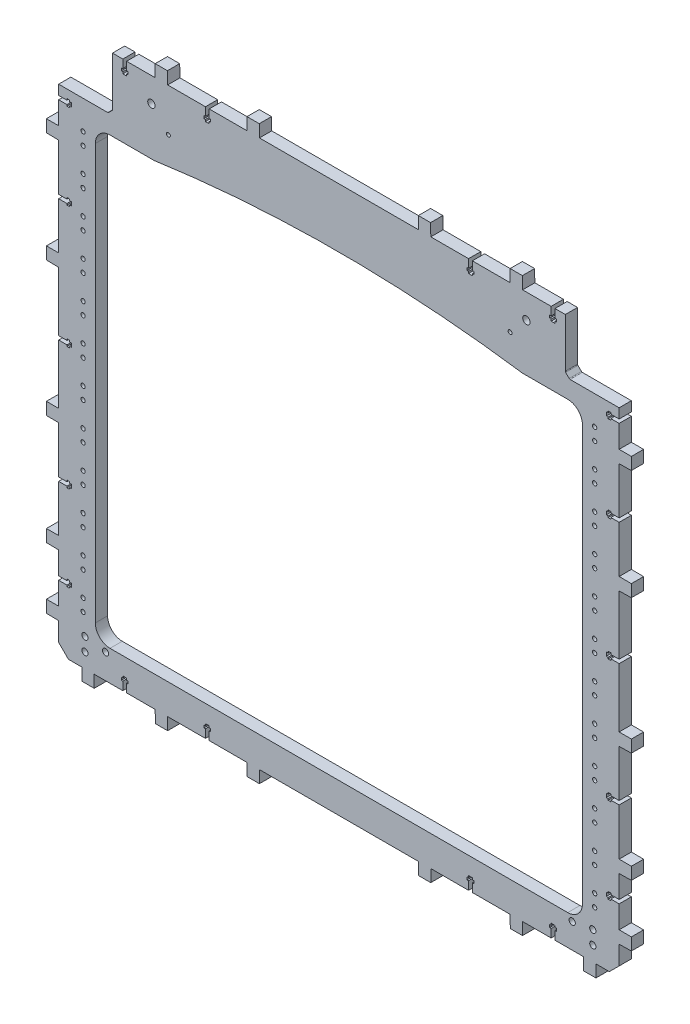
from build123d import *

# Parameters (mm, degrees)
SKETCH_1_R      = 1.75
SKETCH_1_R_2    = 2.55
SKETCH_1_R_3    = 3
SKETCH_1_R_4    = 1.6
EXTRUDE_1_DEPTH = 10


with BuildPart() as part:
    # Эскиз1 → Бобышка-Вытянуть1 (new body)
    with BuildSketch(Plane.XY):
        with BuildLine():
            Line((109.05, 213), (105.95, 213))
            Line((105.95, 213), (105.95, 214.5))
            Line((105.95, 214.5), (104.75, 214.5))
            Line((104.75, 214.5), (104.75, 216.7))
            Line((104.75, 216.7), (105.95, 216.7))
            Line((105.95, 216.7), (105.95, 223.5))
            Line((105.95, 223.5), (75.100000001, 223.5))
            Line((75.100000001, 223.5), (74.933356476, 233.498611401))
            Line((74.933356476, 233.498611401), (64.933356476, 233.498611401))
            Line((64.933356476, 233.498611401), (64.9, 223.5))
            Line((64.9, 223.5), (-64.899999999, 223.5))
            Line((-64.899999999, 223.5), (-65.066643524, 233.498611401))
            Line((-65.066643524, 233.498611401), (-75.066643524, 233.498611401))
            Line((-75.066643524, 233.498611401), (-75.1, 223.5))
            Line((-75.1, 223.5), (-105.95, 223.5))
            Line((-105.95, 223.5), (-105.95, 216.7))
            Line((-105.95, 216.7), (-104.75, 216.7))
            Line((-104.75, 216.7), (-104.75, 214.5))
            Line((-104.75, 214.5), (-105.95, 214.5))
            Line((-105.95, 214.5), (-105.95, 213))
            Line((-105.95, 213), (-109.05, 213))
            Line((-109.05, 213), (-109.05, 214.5))
            Line((-109.05, 214.5), (-110.25, 214.5))
            Line((-110.25, 214.5), (-110.25, 216.7))
            Line((-110.25, 216.7), (-109.05, 216.7))
            Line((-109.05, 216.7), (-109.05, 223.5))
            Line((-109.05, 223.5), (-139.899999999, 223.5))
            Line((-139.899999999, 223.5), (-140.066643524, 233.498611401))
            Line((-140.066643524, 233.498611401), (-150.066643524, 233.498611401))
            Line((-150.066643524, 233.498611401), (-150.1, 223.5))
            Line((-150.1, 223.5), (-173.45, 223.5))
            Line((-173.45, 223.5), (-173.45, 216.7))
            Line((-173.45, 216.7), (-172.25, 216.7))
            Line((-172.25, 216.7), (-172.25, 214.5))
            Line((-172.25, 214.5), (-173.45, 214.5))
            Line((-173.45, 214.5), (-173.45, 213))
            Line((-173.45, 213), (-176.55, 213))
            Line((-176.55, 213), (-176.55, 214.5))
            Line((-176.55, 214.5), (-177.75, 214.5))
            Line((-177.75, 214.5), (-177.75, 216.7))
            Line((-177.75, 216.7), (-176.55, 216.7))
            Line((-176.55, 216.7), (-176.55, 223.5))
            Line((-176.55, 223.5), (-185, 223.5))
            Line((-185, 223.5), (-185, 183.414213563))
            ThreePointArc((-185, 183.414213563), (-185.076120468, 183.03153013), (-185.292893219, 182.707106782))
            Line((-185.292893219, 182.707106782), (-188.207106781, 179.792893219))
            ThreePointArc((-188.207106781, 179.792893219), (-188.53153013, 179.576120468), (-188.914213562, 179.5))
            Line((-188.914213562, 179.5), (-229, 179.5))
            Line((-229, 179.5), (-229, 171.550000001))
            Line((-229, 171.550000001), (-222.2, 171.550000001))
            Line((-222.2, 171.550000001), (-222.2, 172.750000001))
            Line((-222.2, 172.750000001), (-220, 172.750000001))
            Line((-220, 172.750000001), (-220, 171.550000001))
            Line((-220, 171.550000001), (-218.5, 171.550000001))
            Line((-218.5, 171.550000001), (-218.5, 168.450000001))
            Line((-218.5, 168.450000001), (-220, 168.450000001))
            Line((-220, 168.450000001), (-220, 167.250000001))
            Line((-220, 167.250000001), (-222.2, 167.250000001))
            Line((-222.2, 167.250000001), (-222.2, 168.450000001))
            Line((-222.2, 168.450000001), (-229, 168.450000001))
            Line((-229, 168.450000001), (-229, 150.100000001))
            Line((-229, 150.100000001), (-238.9986114, 150.066643525))
            Line((-238.9986114, 150.066643525), (-238.9986114, 140.066643525))
            Line((-238.9986114, 140.066643525), (-229, 139.9))
            Line((-229, 139.9), (-229, 101.550000001))
            Line((-229, 101.550000001), (-222.2, 101.550000001))
            Line((-222.2, 101.550000001), (-222.2, 102.750000001))
            Line((-222.2, 102.750000001), (-220, 102.750000001))
            Line((-220, 102.750000001), (-220, 101.550000001))
            Line((-220, 101.550000001), (-218.5, 101.550000001))
            Line((-218.5, 101.550000001), (-218.5, 98.450000001))
            Line((-218.5, 98.450000001), (-220, 98.450000001))
            Line((-220, 98.450000001), (-220, 97.250000001))
            Line((-220, 97.250000001), (-222.2, 97.250000001))
            Line((-222.2, 97.250000001), (-222.2, 98.450000001))
            Line((-222.2, 98.450000001), (-229, 98.450000001))
            Line((-229, 98.450000001), (-229, 60.100000001))
            Line((-229, 60.100000001), (-238.9986114, 60.066643525))
            Line((-238.9986114, 60.066643525), (-238.9986114, 50.066643525))
            Line((-238.9986114, 50.066643525), (-229, 49.9))
            Line((-229, 49.9), (-229, 1.55))
            Line((-229, 1.55), (-222.2, 1.55))
            Line((-222.2, 1.55), (-222.2, 2.75))
            Line((-222.2, 2.75), (-220, 2.75))
            Line((-220, 2.75), (-220, 1.55))
            Line((-220, 1.55), (-218.5, 1.55))
            Line((-218.5, 1.55), (-218.5, -1.55))
            Line((-218.5, -1.55), (-220, -1.55))
            Line((-220, -1.55), (-220, -2.75))
            Line((-220, -2.75), (-222.2, -2.75))
            Line((-222.2, -2.75), (-222.2, -1.55))
            Line((-222.2, -1.55), (-229, -1.55))
            Line((-229, -1.55), (-229, -49.9))
            Line((-229, -49.9), (-238.998611401, -49.933356476))
            Line((-238.998611401, -49.933356476), (-238.998611401, -59.933356476))
            Line((-238.998611401, -59.933356476), (-229, -60.100000001))
            Line((-229, -60.100000001), (-229, -98.45))
            Line((-229, -98.45), (-222.2, -98.45))
            Line((-222.2, -98.45), (-222.2, -97.25))
            Line((-222.2, -97.25), (-220, -97.25))
            Line((-220, -97.25), (-220, -98.45))
            Line((-220, -98.45), (-218.5, -98.45))
            Line((-218.5, -98.45), (-218.5, -101.55))
            Line((-218.5, -101.55), (-220, -101.55))
            Line((-220, -101.55), (-220, -102.75))
            Line((-220, -102.75), (-222.2, -102.75))
            Line((-222.2, -102.75), (-222.2, -101.55))
            Line((-222.2, -101.55), (-229, -101.55))
            Line((-229, -101.55), (-229, -139.9))
            Line((-229, -139.9), (-238.998611401, -139.933356476))
            Line((-238.998611401, -139.933356476), (-238.998611401, -149.933356476))
            Line((-238.998611401, -149.933356476), (-229, -150.100000001))
            Line((-229, -150.100000001), (-229, -168.45))
            Line((-229, -168.45), (-222.2, -168.45))
            Line((-222.2, -168.45), (-222.2, -167.25))
            Line((-222.2, -167.25), (-220, -167.25))
            Line((-220, -167.25), (-220, -168.45))
            Line((-220, -168.45), (-218.5, -168.45))
            Line((-218.5, -168.45), (-218.5, -171.55))
            Line((-218.5, -171.55), (-220, -171.55))
            Line((-220, -171.55), (-220, -172.75))
            Line((-220, -172.75), (-222.2, -172.75))
            Line((-222.2, -172.75), (-222.2, -171.55))
            Line((-222.2, -171.55), (-229, -171.55))
            Line((-229, -171.55), (-229, -189.9))
            Line((-229, -189.9), (-238.998611401, -189.933356476))
            Line((-238.998611401, -189.933356476), (-238.998611401, -199.933356476))
            Line((-238.998611401, -199.933356476), (-229, -200.100000001))
            Line((-229, -200.100000001), (-229, -215.5))
            Line((-229, -215.5), (-221, -223.5))
            Line((-221, -223.5), (-210.100000001, -223.5))
            Line((-210.100000001, -223.5), (-209.933356476, -233.4986114))
            Line((-209.933356476, -233.4986114), (-199.933356476, -233.4986114))
            Line((-199.933356476, -233.4986114), (-199.9, -223.5))
            Line((-199.9, -223.5), (-176.55, -223.5))
            Line((-176.55, -223.5), (-176.55, -216.7))
            Line((-176.55, -216.7), (-177.749999999, -216.7))
            Line((-177.749999999, -216.7), (-177.749999999, -214.5))
            Line((-177.749999999, -214.5), (-176.549999999, -214.5))
            Line((-176.549999999, -214.5), (-176.549999999, -213))
            Line((-176.549999999, -213), (-173.449999999, -213))
            Line((-173.449999999, -213), (-173.449999999, -214.5))
            Line((-173.449999999, -214.5), (-172.25, -214.5))
            Line((-172.25, -214.5), (-172.25, -216.7))
            Line((-172.25, -216.7), (-173.45, -216.7))
            Line((-173.45, -216.7), (-173.45, -223.5))
            Line((-173.45, -223.5), (-150.100000001, -223.5))
            Line((-150.100000001, -223.5), (-149.933356476, -233.498611401))
            Line((-149.933356476, -233.498611401), (-139.933356476, -233.498611401))
            Line((-139.933356476, -233.498611401), (-139.9, -223.5))
            Line((-139.9, -223.5), (-109.05, -223.5))
            Line((-109.05, -223.5), (-109.05, -216.7))
            Line((-109.05, -216.7), (-110.249999999, -216.7))
            Line((-110.249999999, -216.7), (-110.249999999, -214.5))
            Line((-110.249999999, -214.5), (-109.049999999, -214.5))
            Line((-109.049999999, -214.5), (-109.049999999, -213))
            Line((-109.049999999, -213), (-105.949999999, -213))
            Line((-105.949999999, -213), (-105.949999999, -214.5))
            Line((-105.949999999, -214.5), (-104.75, -214.5))
            Line((-104.75, -214.5), (-104.75, -216.7))
            Line((-104.75, -216.7), (-105.95, -216.7))
            Line((-105.95, -216.7), (-105.95, -223.5))
            Line((-105.95, -223.5), (-75.1, -223.5))
            Line((-75.1, -223.5), (-74.933356476, -233.498611401))
            Line((-74.933356476, -233.498611401), (-64.933356476, -233.498611401))
            Line((-64.933356476, -233.498611401), (-64.9, -223.5))
            Line((-64.9, -223.5), (64.9, -223.5))
            Line((64.9, -223.5), (65.066643524, -233.498611401))
            Line((65.066643524, -233.498611401), (75.066643524, -233.498611401))
            Line((75.066643524, -233.498611401), (75.1, -223.5))
            Line((75.1, -223.5), (105.95, -223.5))
            Line((105.95, -223.5), (105.95, -216.7))
            Line((105.95, -216.7), (104.75, -216.7))
            Line((104.75, -216.7), (104.75, -214.5))
            Line((104.75, -214.5), (105.95, -214.5))
            Line((105.95, -214.5), (105.95, -213))
            Line((105.95, -213), (109.05, -213))
            Line((109.05, -213), (109.05, -214.5))
            Line((109.05, -214.5), (110.25, -214.5))
            Line((110.25, -214.5), (110.25, -216.7))
            Line((110.25, -216.7), (109.05, -216.7))
            Line((109.05, -216.7), (109.05, -223.5))
            Line((109.05, -223.5), (139.9, -223.5))
            Line((139.9, -223.5), (140.066643524, -233.4986114))
            Line((140.066643524, -233.4986114), (150.028559144, -233.4986114))
            Line((150.028559144, -233.4986114), (150.1, -223.5))
            Line((150.1, -223.5), (173.45, -223.5))
            Line((173.45, -223.5), (173.45, -216.7))
            Line((173.45, -216.7), (172.25, -216.7))
            Line((172.25, -216.7), (172.25, -214.5))
            Line((172.25, -214.5), (173.45, -214.5))
            Line((173.45, -214.5), (173.45, -213))
            Line((173.45, -213), (176.55, -213))
            Line((176.55, -213), (176.55, -214.5))
            Line((176.55, -214.5), (177.75, -214.5))
            Line((177.75, -214.5), (177.75, -216.7))
            Line((177.75, -216.7), (176.55, -216.7))
            Line((176.55, -216.7), (176.55, -223.5))
            Line((176.55, -223.5), (199.9, -223.5))
            Line((199.9, -223.5), (200.066643523, -233.4986114))
            Line((200.066643523, -233.4986114), (210.028559144, -233.4986114))
            Line((210.028559144, -233.4986114), (210.1, -223.5))
            Line((210.1, -223.5), (221, -223.5))
            Line((221, -223.5), (229, -215.5))
            Line((229, -215.5), (229, -200.100000001))
            Line((229, -200.100000001), (238.9986114, -199.933356476))
            Line((238.9986114, -199.933356476), (238.9986114, -189.933356476))
            Line((238.9986114, -189.933356476), (229, -189.9))
            Line((229, -189.9), (229, -171.55))
            Line((229, -171.55), (222.2, -171.55))
            Line((222.2, -171.55), (222.2, -172.75))
            Line((222.2, -172.75), (220, -172.75))
            Line((220, -172.75), (220, -171.55))
            Line((220, -171.55), (218.5, -171.55))
            Line((218.5, -171.55), (218.5, -168.45))
            Line((218.5, -168.45), (220, -168.45))
            Line((220, -168.45), (220, -167.25))
            Line((220, -167.25), (222.2, -167.25))
            Line((222.2, -167.25), (222.2, -168.45))
            Line((222.2, -168.45), (229, -168.45))
            Line((229, -168.45), (229, -150.100000001))
            Line((229, -150.100000001), (238.998611401, -149.933356476))
            Line((238.998611401, -149.933356476), (238.998611401, -139.933356476))
            Line((238.998611401, -139.933356476), (229, -139.9))
            Line((229, -139.9), (229, -101.55))
            Line((229, -101.55), (222.2, -101.55))
            Line((222.2, -101.55), (222.2, -102.75))
            Line((222.2, -102.75), (220, -102.75))
            Line((220, -102.75), (220, -101.55))
            Line((220, -101.55), (218.5, -101.55))
            Line((218.5, -101.55), (218.5, -98.45))
            Line((218.5, -98.45), (220, -98.45))
            Line((220, -98.45), (220, -97.25))
            Line((220, -97.25), (222.2, -97.25))
            Line((222.2, -97.25), (222.2, -98.45))
            Line((222.2, -98.45), (229, -98.45))
            Line((229, -98.45), (229, -60.100000001))
            Line((229, -60.100000001), (238.9986114, -59.933356476))
            Line((238.9986114, -59.933356476), (238.9986114, -49.933356476))
            Line((238.9986114, -49.933356476), (229, -49.9))
            Line((229, -49.9), (229, -1.55))
            Line((229, -1.55), (222.2, -1.55))
            Line((222.2, -1.55), (222.2, -2.75))
            Line((222.2, -2.75), (220, -2.75))
            Line((220, -2.75), (220, -1.55))
            Line((220, -1.55), (218.5, -1.55))
            Line((218.5, -1.55), (218.5, 1.55))
            Line((218.5, 1.55), (220, 1.55))
            Line((220, 1.55), (220, 2.75))
            Line((220, 2.75), (222.2, 2.75))
            Line((222.2, 2.75), (222.2, 1.55))
            Line((222.2, 1.55), (229, 1.55))
            Line((229, 1.55), (229, 49.899999999))
            Line((229, 49.899999999), (238.9986114, 50.066643524))
            Line((238.9986114, 50.066643524), (238.9986114, 60.066643524))
            Line((238.9986114, 60.066643524), (229, 60.1))
            Line((229, 60.1), (229, 98.45))
            Line((229, 98.45), (222.2, 98.45))
            Line((222.2, 98.45), (222.2, 97.250000001))
            Line((222.2, 97.250000001), (220, 97.250000001))
            Line((220, 97.250000001), (220, 98.450000001))
            Line((220, 98.450000001), (218.5, 98.450000001))
            Line((218.5, 98.450000001), (218.5, 101.550000001))
            Line((218.5, 101.550000001), (220, 101.550000001))
            Line((220, 101.550000001), (220, 102.750000001))
            Line((220, 102.750000001), (222.2, 102.750000001))
            Line((222.2, 102.750000001), (222.2, 101.550000001))
            Line((222.2, 101.550000001), (229, 101.550000001))
            Line((229, 101.550000001), (229, 139.899999999))
            Line((229, 139.899999999), (238.9986114, 140.066643524))
            Line((238.9986114, 140.066643524), (238.9986114, 150.066643524))
            Line((238.9986114, 150.066643524), (229, 150.1))
            Line((229, 150.1), (229, 168.45))
            Line((229, 168.45), (222.2, 168.45))
            Line((222.2, 168.45), (222.2, 167.250000001))
            Line((222.2, 167.250000001), (220, 167.250000001))
            Line((220, 167.250000001), (220, 168.450000001))
            Line((220, 168.450000001), (218.5, 168.450000001))
            Line((218.5, 168.450000001), (218.5, 171.550000001))
            Line((218.5, 171.550000001), (220, 171.550000001))
            Line((220, 171.550000001), (220, 172.750000001))
            Line((220, 172.750000001), (222.2, 172.750000001))
            Line((222.2, 172.750000001), (222.2, 171.550000001))
            Line((222.2, 171.550000001), (229, 171.550000001))
            Line((229, 171.550000001), (229, 179.5))
            Line((229, 179.5), (188.914213562, 179.5))
            ThreePointArc((188.914213562, 179.5), (188.53153013, 179.576120468), (188.207106781, 179.792893219))
            Line((188.207106781, 179.792893219), (185.292893219, 182.707106782))
            ThreePointArc((185.292893219, 182.707106782), (185.076120467, 183.03153013), (185, 183.414213563))
            Line((185, 183.414213563), (185, 223.5))
            Line((185, 223.5), (176.55, 223.5))
            Line((176.55, 223.5), (176.55, 216.7))
            Line((176.55, 216.7), (177.75, 216.7))
            Line((177.75, 216.7), (177.75, 214.5))
            Line((177.75, 214.5), (176.55, 214.5))
            Line((176.55, 214.5), (176.55, 213))
            Line((176.55, 213), (173.45, 213))
            Line((173.45, 213), (173.45, 214.5))
            Line((173.45, 214.5), (172.25, 214.5))
            Line((172.25, 214.5), (172.25, 216.7))
            Line((172.25, 216.7), (173.45, 216.7))
            Line((173.45, 216.7), (173.45, 223.5))
            Line((173.45, 223.5), (150.100000001, 223.5))
            Line((150.100000001, 223.5), (149.933356476, 233.498611401))
            Line((149.933356476, 233.498611401), (139.933356476, 233.498611401))
            Line((139.933356476, 233.498611401), (139.9, 223.5))
            Line((139.9, 223.5), (109.05, 223.5))
            Line((109.05, 223.5), (109.05, 216.7))
            Line((109.05, 216.7), (110.25, 216.7))
            Line((110.25, 216.7), (110.25, 214.5))
            Line((110.25, 214.5), (109.05, 214.5))
            Line((109.05, 214.5), (109.05, 213))
        make_face()
        with Locations((-209, 156.000000219)):
            Circle(SKETCH_1_R, mode=Mode.SUBTRACT)
        with Locations((-209, 96.000000219)):
            Circle(SKETCH_1_R, mode=Mode.SUBTRACT)
        with Locations((-209, 56.000000219)):
            Circle(SKETCH_1_R, mode=Mode.SUBTRACT)
        with Locations((209, 56)):
            Circle(SKETCH_1_R, mode=Mode.SUBTRACT)
        with Locations((209, 156)):
            Circle(SKETCH_1_R, mode=Mode.SUBTRACT)
        with Locations((209, 116)):
            Circle(SKETCH_1_R, mode=Mode.SUBTRACT)
        with Locations((209, -114)):
            Circle(SKETCH_1_R, mode=Mode.SUBTRACT)
        with Locations((209, -154)):
            Circle(SKETCH_1_R, mode=Mode.SUBTRACT)
        with Locations((-209, -93.999999781)):
            Circle(SKETCH_1_R, mode=Mode.SUBTRACT)
        with Locations((-207.5, -200.5)):
            Circle(SKETCH_1_R_2, mode=Mode.SUBTRACT)
        with Locations((207.5, -200.5)):
            Circle(SKETCH_1_R_2, mode=Mode.SUBTRACT)
        with Locations((-209, -153.999999781)):
            Circle(SKETCH_1_R, mode=Mode.SUBTRACT)
        with Locations((-209, -113.999999781)):
            Circle(SKETCH_1_R, mode=Mode.SUBTRACT)
        with Locations((-209, 116.000000219)):
            Circle(SKETCH_1_R, mode=Mode.SUBTRACT)
        with Locations((209, -94)):
            Circle(SKETCH_1_R, mode=Mode.SUBTRACT)
        with Locations((209, 96)):
            Circle(SKETCH_1_R, mode=Mode.SUBTRACT)
        with Locations((209, 36)):
            Circle(SKETCH_1_R, mode=Mode.SUBTRACT)
        with Locations((-209, 36.000000219)):
            Circle(SKETCH_1_R, mode=Mode.SUBTRACT)
        with Locations((207.5, -211.5)):
            Circle(SKETCH_1_R_2, mode=Mode.SUBTRACT)
        with Locations((190.647208966, -203.210466353)):
            Circle(SKETCH_1_R_2, mode=Mode.SUBTRACT)
        with Locations((-207.5, -211.5)):
            Circle(SKETCH_1_R_2, mode=Mode.SUBTRACT)
        with Locations((-190.65, -203.210466353)):
            Circle(SKETCH_1_R_2, mode=Mode.SUBTRACT)
        with Locations((209, -184)):
            Circle(SKETCH_1_R, mode=Mode.SUBTRACT)
        with Locations((-209, -183.999999781)):
            Circle(SKETCH_1_R, mode=Mode.SUBTRACT)
        with Locations((-209, 66.000000219)):
            Circle(SKETCH_1_R, mode=Mode.SUBTRACT)
        with Locations((-209, 146.000000219)):
            Circle(SKETCH_1_R, mode=Mode.SUBTRACT)
        with Locations((-209, 86.000000219)):
            Circle(SKETCH_1_R, mode=Mode.SUBTRACT)
        with Locations((-209, -83.999999781)):
            Circle(SKETCH_1_R, mode=Mode.SUBTRACT)
        with Locations((-209, -123.999999781)):
            Circle(SKETCH_1_R, mode=Mode.SUBTRACT)
        with Locations((-209, -143.999999781)):
            Circle(SKETCH_1_R, mode=Mode.SUBTRACT)
        with Locations((-209, 26.000000219)):
            Circle(SKETCH_1_R, mode=Mode.SUBTRACT)
        with Locations((-209, 126.000000219)):
            Circle(SKETCH_1_R, mode=Mode.SUBTRACT)
        with Locations((-209, -173.999999781)):
            Circle(SKETCH_1_R, mode=Mode.SUBTRACT)
        with Locations((209, 66)):
            Circle(SKETCH_1_R, mode=Mode.SUBTRACT)
        with Locations((209, 126)):
            Circle(SKETCH_1_R, mode=Mode.SUBTRACT)
        with Locations((209, 86)):
            Circle(SKETCH_1_R, mode=Mode.SUBTRACT)
        with Locations((209, -144)):
            Circle(SKETCH_1_R, mode=Mode.SUBTRACT)
        with Locations((209, -124)):
            Circle(SKETCH_1_R, mode=Mode.SUBTRACT)
        with Locations((209, -84)):
            Circle(SKETCH_1_R, mode=Mode.SUBTRACT)
        with Locations((209, 146)):
            Circle(SKETCH_1_R, mode=Mode.SUBTRACT)
        with Locations((209, 26)):
            Circle(SKETCH_1_R, mode=Mode.SUBTRACT)
        with Locations((209, -174)):
            Circle(SKETCH_1_R, mode=Mode.SUBTRACT)
        with Locations((209, -4)):
            Circle(SKETCH_1_R, mode=Mode.SUBTRACT)
        with Locations((209, -24)):
            Circle(SKETCH_1_R, mode=Mode.SUBTRACT)
        with Locations((209, 6)):
            Circle(SKETCH_1_R, mode=Mode.SUBTRACT)
        with Locations((209, -34)):
            Circle(SKETCH_1_R, mode=Mode.SUBTRACT)
        with Locations((-209, -3.999999781)):
            Circle(SKETCH_1_R, mode=Mode.SUBTRACT)
        with Locations((-209, -23.999999781)):
            Circle(SKETCH_1_R, mode=Mode.SUBTRACT)
        with Locations((-209, 6.000000219)):
            Circle(SKETCH_1_R, mode=Mode.SUBTRACT)
        with Locations((-209, -33.999999781)):
            Circle(SKETCH_1_R, mode=Mode.SUBTRACT)
        with Locations((-209, -53.999999781)):
            Circle(SKETCH_1_R, mode=Mode.SUBTRACT)
        with Locations((-209, -63.999999781)):
            Circle(SKETCH_1_R, mode=Mode.SUBTRACT)
        with Locations((209, -54)):
            Circle(SKETCH_1_R, mode=Mode.SUBTRACT)
        with Locations((209, -64)):
            Circle(SKETCH_1_R, mode=Mode.SUBTRACT)
        with Locations((-153.2, 203.6)):
            Circle(SKETCH_1_R_3, mode=Mode.SUBTRACT)
        with Locations((153.2, 203.6)):
            Circle(SKETCH_1_R_3, mode=Mode.SUBTRACT)
        with Locations((-139.316747662, 188.504860099)):
            Circle(SKETCH_1_R_4, mode=Mode.SUBTRACT)
        with Locations((139.9, 188.5)):
            Circle(SKETCH_1_R_4, mode=Mode.SUBTRACT)
        with BuildLine():
            Line((-199, -186.720698764), (-199, 152.500000001))
            ThreePointArc((-199, 152.500000001), (-195.485281374, 160.985281375), (-187, 164.5))
            Line((-187, 164.5), (-151.016666667, 164.5))
            ThreePointArc((-151.016666667, 164.5), (-0.458333333, 175.20955726), (150.100000001, 164.5))
            Line((150.100000001, 164.5), (186.999996373, 164.5))
            ThreePointArc((186.999996373, 164.5), (195.485291242, 160.98526788), (198.999996373, 152.499961831))
            Line((198.999996373, 152.499961831), (198.99928388, -186.720738008))
            ThreePointArc((198.99928388, -186.720738008), (195.484551381, -195.205994016), (186.999283881, -198.720698768))
            Line((186.999283881, -198.720698768), (-187.000002696, -198.720698768))
            ThreePointArc((-187.000002696, -198.720698768), (-195.485282723, -195.205979582), (-199, -186.720698764))
        make_face(mode=Mode.SUBTRACT)
    extrude(amount=EXTRUDE_1_DEPTH)


solid = part.part
